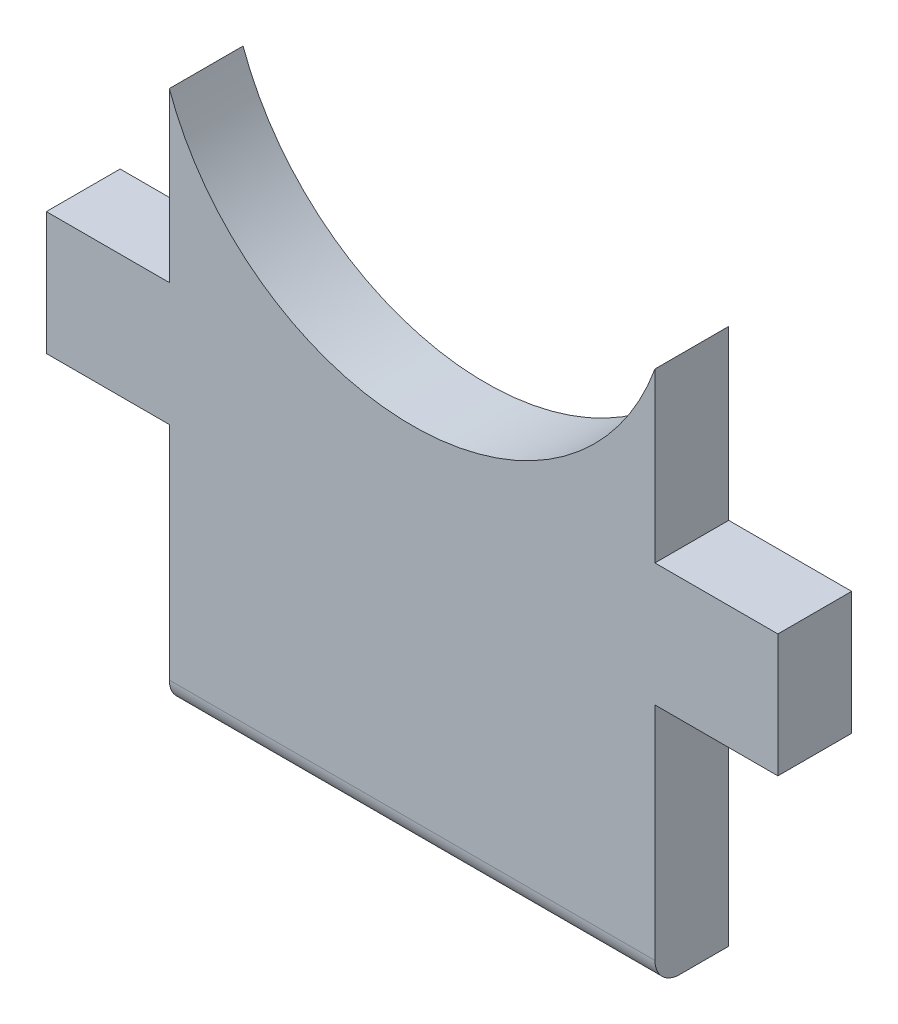
from build123d import *

# Parameters (mm, degrees)
CROQUIS1_R              = 9.875
CROQUIS1_W              = 5
CROQUIS1_H              = 5
SALIENTE_EXTRUIR1_DEPTH = 3
REDONDEO1_R             = 1
CROQUIS2_R              = 10.5
CORTAR_EXTRUIR1_DEPTH   = 10


with BuildPart() as part:
    # Croquis1 → Saliente-Extruir1 (new body)
    with BuildSketch(Plane.XY):
        Circle(CROQUIS1_R)
        with BuildLine():
            ThreePointArc((9.875, 0), (0, -9.875), (-9.875, 0))
            Line((-9.875, 0), (-9.875, -10.4))
            Line((-9.875, -10.4), (-9.875, -15.4))
            Line((-9.875, -15.4), (-9.875, -25.4))
            Line((-9.875, -25.4), (9.875, -25.4))
            Line((9.875, -25.4), (9.875, -15.4))
            Line((9.875, -15.4), (9.875, -10.4))
            Line((9.875, -10.4), (9.875, 0))
        make_face()
        with Locations((12.375, -12.9)):
            Rectangle(CROQUIS1_W, CROQUIS1_H)
        with Locations((-12.375, -12.9)):
            Rectangle(CROQUIS1_W, CROQUIS1_H)
    extrude(amount=SALIENTE_EXTRUIR1_DEPTH)

    # Redondeo1
    redondeo1_edges = [part.edges().sort_by_distance(p)[0] for p in [
        (0, -25.4, 3),
    ]]
    fillet(redondeo1_edges, radius=REDONDEO1_R)

    # Croquis2 → Cortar-Extruir1 (cut)
    with BuildSketch(Plane.XY.offset(3)):
        Circle(CROQUIS2_R)
    extrude(amount=-CORTAR_EXTRUIR1_DEPTH, mode=Mode.SUBTRACT)


solid = part.part
